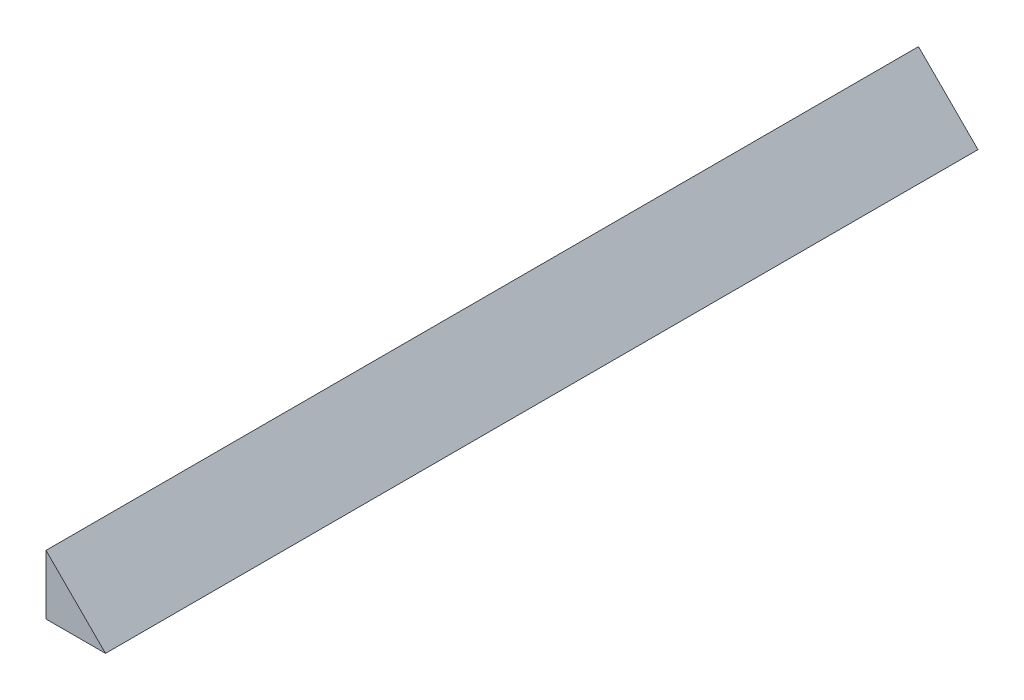
from build123d import *

# Parameters (mm, degrees)
BOSS_EXTRUDE1_DEPTH = 220


with BuildPart() as part:
    # Sketch2 → Boss-Extrude1 (new body)
    with BuildSketch(Plane.XY):
        Polygon((0, 0), (0, 15), (15, 0), align=None)
    extrude(amount=BOSS_EXTRUDE1_DEPTH)


solid = part.part
